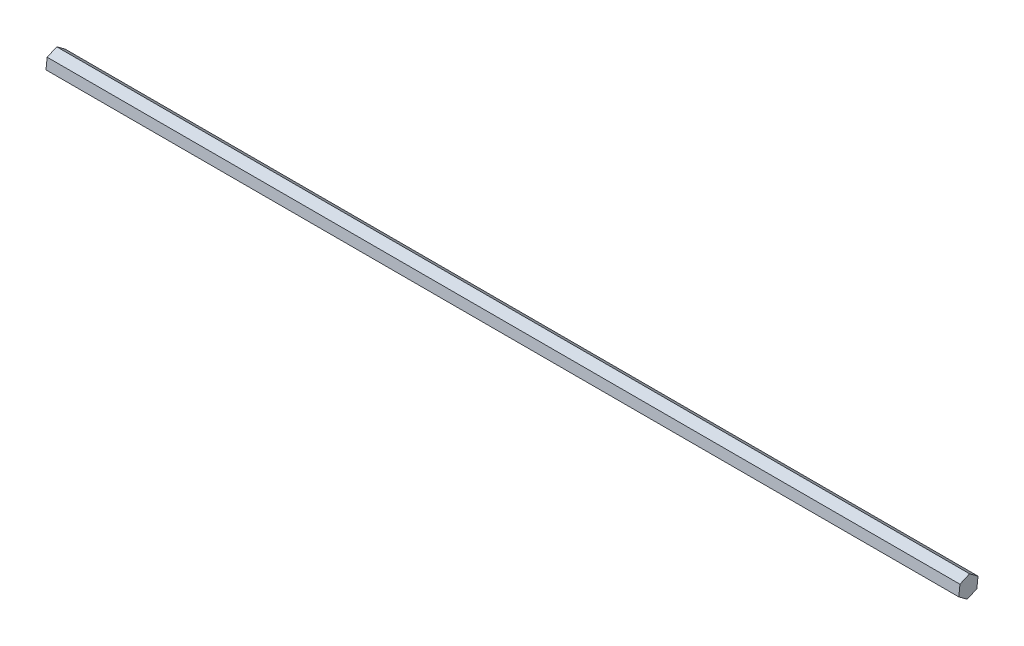
from build123d import *

# Parameters (mm, degrees)
BOSS_EXTRUDE1_DEPTH = 50
BOSS_EXTRUDE2_DEPTH = 25.4


with BuildPart() as part:
    # Sketch1 → Boss-Extrude1 (new body)
    with BuildSketch(Plane(origin=(0, 0, 0), x_dir=(0, 0, -1), z_dir=(1, 0, 0))):
        Polygon((-0.697410306, 0.513438277), (-0.793355745, -0.347255904), (-0.095945438, -0.860694181), (0.697410306, -0.513438277), (0.793355745, 0.347255904), (0.095945438, 0.860694181), align=None)
    extrude(amount=BOSS_EXTRUDE1_DEPTH)

    # Sketch2 → Boss-Extrude2 (add)
    with BuildSketch(Plane.ZY):
        Polygon((-0.793355745, 0.347255904), (-0.697410306, -0.513438277), (0.095945438, -0.860694181), (0.793355745, -0.347255904), (0.697410306, 0.513438277), (-0.095945438, 0.860694181), align=None)
    extrude(amount=BOSS_EXTRUDE2_DEPTH)


solid = part.part
